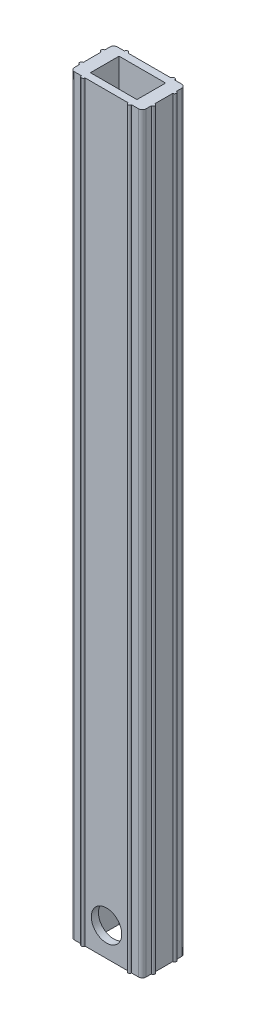
from build123d import *

# Parameters (mm, degrees)
EXTRUDE_1_DEPTH          = 105
EXTRUDE_1_DEPTH_BACK     = 105
SKETCH_1_W               = 13
SKETCH_1_H               = 8
CUT_EXTRUDE_1_DEPTH      = 107.261469969
CUT_EXTRUDE_1_DEPTH_BACK = 107.261469969
SKETCH_2_R               = 4.25
SKETCH_3_R               = 3
CUT_EXTRUDE_2_DEPTH      = 106.723696492


with BuildPart() as part:
    # Эскиз1 → Бобышка-Вытянуть1 (new, two sides: drawn at the far end of the back side and taken through both)
    with BuildSketch(Plane(origin=(0, 0, 0), x_dir=(1, 0, 0), z_dir=(0, 1, 0)).offset(-EXTRUDE_1_DEPTH_BACK)):
        with BuildLine():
            Line((-10, 3.5), (-10, 5))
            ThreePointArc((-10, 5), (-9.707106781, 5.707106781), (-9, 6))
            Line((-9, 6), (-7, 6))
            ThreePointArc((-7, 6), (-6.5, 6.5), (-6, 6))
            Line((-6, 6), (6, 6))
            ThreePointArc((6, 6), (6.5, 6.5), (7, 6))
            Line((7, 6), (9, 6))
            ThreePointArc((9, 6), (9.707106781, 5.707106781), (10, 5))
            Line((10, 5), (10, 3.5))
            ThreePointArc((10, 3.5), (10.5, 3), (10, 2.5))
            Line((10, 2.5), (10, -2.5))
            ThreePointArc((10, -2.5), (10.5, -3), (10, -3.5))
            Line((10, -3.5), (10, -5))
            ThreePointArc((10, -5), (9.707106781, -5.707106781), (9, -6))
            Line((9, -6), (7, -6))
            ThreePointArc((7, -6), (6.5, -6.5), (6, -6))
            Line((6, -6), (-6, -6))
            ThreePointArc((-6, -6), (-6.5, -6.5), (-7, -6))
            Line((-7, -6), (-9, -6))
            ThreePointArc((-9, -6), (-9.707106781, -5.707106781), (-10, -5))
            Line((-10, -5), (-10, -3.5))
            ThreePointArc((-10, -3.5), (-10.5, -3), (-10, -2.5))
            Line((-10, -2.5), (-10, 2.5))
            ThreePointArc((-10, 2.5), (-10.5, 3), (-10, 3.5))
        make_face()
        Rectangle(SKETCH_1_W, SKETCH_1_H, mode=Mode.SUBTRACT)
    extrude(amount=EXTRUDE_1_DEPTH + EXTRUDE_1_DEPTH_BACK)

    # Эскиз2 → Вырез-Вытянуть1 (cut, two sides: drawn at the far end of the back side and taken through both)
    with BuildSketch(Plane.XY.offset(6).offset(-CUT_EXTRUDE_1_DEPTH_BACK)):
        with Locations((0, -97)):
            Circle(SKETCH_2_R)
    extrude(amount=CUT_EXTRUDE_1_DEPTH + CUT_EXTRUDE_1_DEPTH_BACK, mode=Mode.SUBTRACT)

    # Эскиз3 → Вырез-Вытянуть2 (cut, through all)
    with BuildSketch(Plane(origin=(0, 0, 0), x_dir=(0, 0, -1), z_dir=(1, 0, 0))):
        with Locations((0, -11)):
            Circle(SKETCH_3_R)
        with Locations((0, 11)):
            Circle(SKETCH_3_R)
        with Locations((0, 33)):
            Circle(SKETCH_3_R)
        with Locations((0, 55)):
            Circle(SKETCH_3_R)
        with Locations((0, 77)):
            Circle(SKETCH_3_R)
        with Locations((0, -33)):
            Circle(SKETCH_3_R)
        with Locations((0, -55)):
            Circle(SKETCH_3_R)
        with Locations((0, -77)):
            Circle(SKETCH_3_R)
    extrude(amount=-CUT_EXTRUDE_2_DEPTH, mode=Mode.SUBTRACT)


solid = part.part
